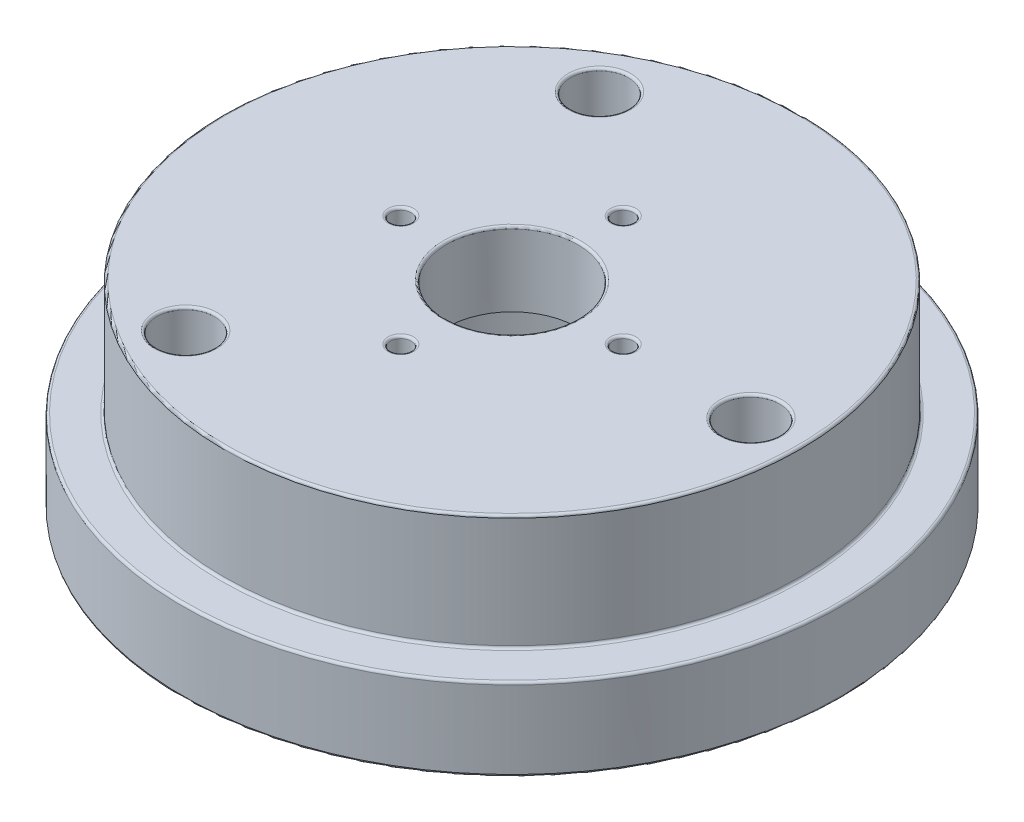
from build123d import *

# Parameters (mm, degrees)
SKETCH2_R          = 1.75
SKETCH2_R_2        = 4
SKETCH2_R_3        = 0.625
CUT_EXTRUDE1_DEPTH = 31.724582991
SKETCH2_3_R        = 10
SKETCH2_3_R_2      = 4
SKETCH2_3_R_3      = 0.625
SKETCH2_3_R_4      = 1.75
CUT_EXTRUDE2_DEPTH = 7.5
FILLET2_R          = 0.15
FILLET3_R          = 0.15


with BuildPart() as part:
    # Sketch1 → Revolve1 (revolve)
    with BuildSketch(Plane.XY):
        Polygon((0, 0), (-20, 0), (-20, 5), (-17.5, 5), (-17.5, 12), (0, 12), align=None)
    revolve(axis=Axis((0, 12, 0), (0, -1, 0)))

    # Sketch2 → Cut-Extrude1 (cut, through all)
    with BuildSketch(Plane.XZ):
        with Locations((14.5, 0)):
            Circle(SKETCH2_R)
        with Locations((-7.25, -12.557368355)):
            Circle(SKETCH2_R)
        with Locations((-7.25, 12.557368355)):
            Circle(SKETCH2_R)
        Circle(SKETCH2_R_2)
        with Locations((6.75, 0)):
            Circle(SKETCH2_R_3)
        with Locations((0, -6.75)):
            Circle(SKETCH2_R_3)
        with Locations((-6.75, 0)):
            Circle(SKETCH2_R_3)
        with Locations((0, 6.75)):
            Circle(SKETCH2_R_3)
    extrude(amount=-CUT_EXTRUDE1_DEPTH, mode=Mode.SUBTRACT)

    # Sketch2<3> → Cut-Extrude2 (cut)
    # profile 1 of 4: a face of its own
    with BuildSketch(Plane.XZ):
        Circle(SKETCH2_3_R)
        Circle(SKETCH2_3_R_2, mode=Mode.SUBTRACT)
        with Locations((6.75, 0)):
            Circle(SKETCH2_3_R_3, mode=Mode.SUBTRACT)
        with Locations((0, -6.75)):
            Circle(SKETCH2_3_R_3, mode=Mode.SUBTRACT)
        with Locations((-6.75, 0)):
            Circle(SKETCH2_3_R_3, mode=Mode.SUBTRACT)
        with Locations((0, 6.75)):
            Circle(SKETCH2_3_R_3, mode=Mode.SUBTRACT)
    # profile 2 of 4: a face of its own
    with BuildSketch(Plane.XZ):
        with Locations((14.5, 0)):
            Circle(SKETCH2_3_R_4)
    # profile 3 of 4: a face of its own
    with BuildSketch(Plane.XZ):
        with Locations((-7.25, -12.557368355)):
            Circle(SKETCH2_3_R_4)
    # profile 4 of 4: a face of its own
    with BuildSketch(Plane.XZ):
        with Locations((-7.25, 12.557368355)):
            Circle(SKETCH2_3_R_4)
    extrude(amount=-CUT_EXTRUDE2_DEPTH, mode=Mode.SUBTRACT)

    # Fillet2
    fillet2_edges = [part.edges().sort_by_distance(p)[0] for p in [
        (17.5, 12, 0),
        (20, 5, 0),
        (17.5, 5, 0),
        (20, 0, 0),
        (12.75, 0, 0),
        (-9, 0, -12.557368355),
        (-9, 0, 12.557368355),
        (-10, 0, 0),
    ]]
    fillet(fillet2_edges, radius=FILLET2_R)

    # Fillet3
    fillet3_edges = [part.edges().sort_by_distance(p)[0] for p in [
        (-7.375, 12, 0),
        (-0.625, 12, 6.75),
        (12.75, 12, 0),
        (-4, 12, 0),
        (6.125, 12, 0),
        (-0.625, 12, -6.75),
        (-9, 12, -12.557368355),
        (-9, 12, 12.557368355),
        (-10, 7.5, 0),
    ]]
    fillet(fillet3_edges, radius=FILLET3_R)


solid = part.part
